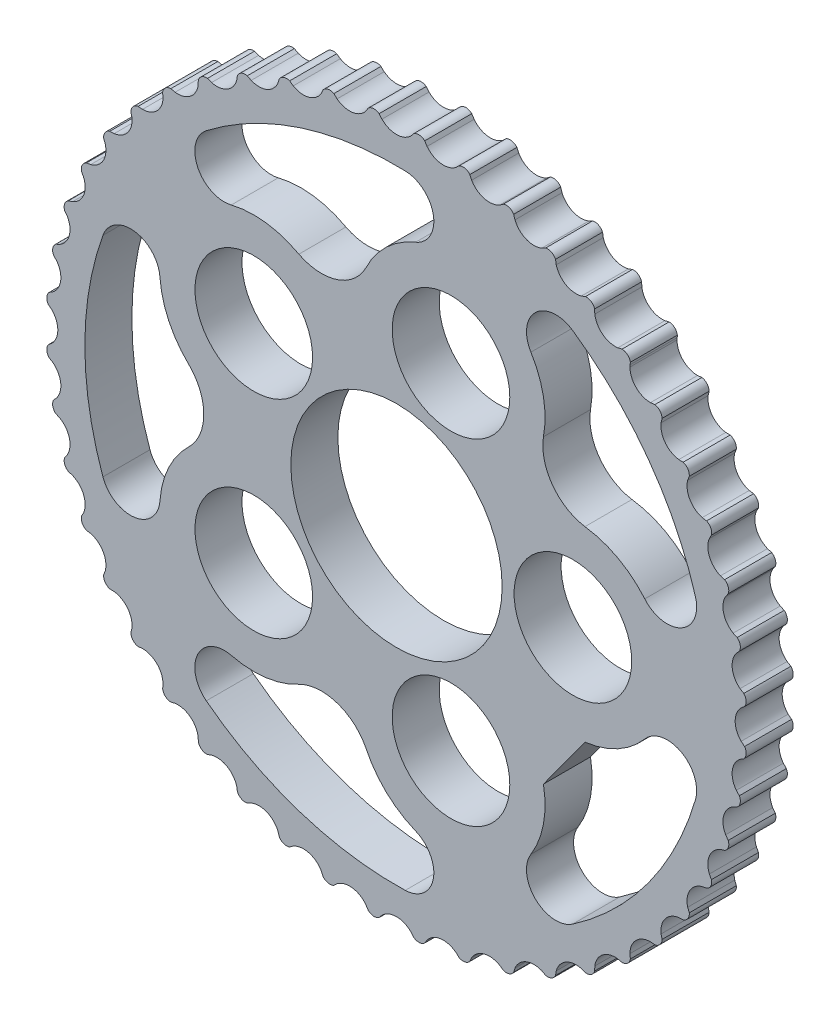
from build123d import *

# Parameters (mm, degrees)
SKETCH_1_R      = 8.985
SKETCH_1_R_2    = 5
EXTRUDE_1_DEPTH = 4


with BuildPart() as part:
    # 草图1 → 凸台-拉伸1 (new body)
    with BuildSketch(Plane.XY):
        with BuildLine():
            Line((29.597334483, -1.467967443), (29.308601455, -1.233462465))
            ThreePointArc((29.308601455, -1.233462465), (28.8, 0), (29.308601455, 1.233462465))
            Line((29.308601455, 1.233462465), (29.597070598, 1.473278304))
            ThreePointArc((29.597070598, 1.473278304), (29.736020929, 1.951681144), (29.535733385, 2.407818592))
            Line((29.535733385, 2.407818592), (29.218861465, 2.602630125))
            ThreePointArc((29.218861465, 2.602630125), (28.553612008, 3.759154336), (28.896863147, 5.048450169))
            Line((28.896863147, 5.048450169), (29.151562149, 5.32386713))
            ThreePointArc((29.151562149, 5.32386713), (29.22687964, 5.816313825), (28.968767699, 6.242406183))
            Line((28.968767699, 6.242406183), (28.629178655, 6.394190991))
            ThreePointArc((28.629178655, 6.394190991), (27.818663797, 7.453988499), (27.9906915, 8.777057492))
            Line((27.9906915, 8.777057492), (28.207262389, 9.083363113))
            ThreePointArc((28.207262389, 9.083363113), (28.217658337, 9.581427764), (27.906138366, 9.970184474))
            Line((27.906138366, 9.970184474), (27.54964266, 10.076345477))
            ThreePointArc((27.54964266, 10.076345477), (26.607730536, 11.021282852), (26.605591361, 12.355486928))
            Line((26.605591361, 12.355486928), (26.780328549, 12.687440235))
            ThreePointArc((26.780328549, 12.687440235), (26.725625076, 13.182600817), (26.366027268, 13.527370144))
            Line((26.366027268, 13.527370144), (25.998724641, 13.586090898))
            ThreePointArc((25.998724641, 13.586090898), (24.941531629, 14.4), (24.765262177, 15.722510556))
            Line((24.765262177, 15.722510556), (24.895175863, 16.074431737))
            ThreePointArc((24.895175863, 16.074431737), (24.77630896, 16.558215916), (24.374786134, 16.853098761))
            Line((24.374786134, 16.853098761), (24.002961236, 16.863374537))
            ThreePointArc((24.002961236, 16.863374537), (22.8485762, 17.532329155), (22.501192491, 18.82051767))
            Line((22.501192491, 18.82051767), (22.584059816, 19.186385256))
            ThreePointArc((22.584059816, 19.186385256), (22.403063329, 19.650515349), (21.966485652, 19.890466185))
            Line((21.966485652, 19.890466185), (21.596500509, 19.852121163))
            ThreePointArc((21.596500509, 19.852121163), (20.364675298, 20.364675298), (19.852121163, 21.596500509))
            Line((19.852121163, 21.596500509), (19.871293674, 21.78149308))
            Line((19.871293674, 21.78149308), (19.886524243, 21.970054403))
            ThreePointArc((19.886524243, 21.970054403), (19.646495073, 22.406589016), (19.182332509, 22.587502218))
            Line((19.182332509, 22.587502218), (18.82051767, 22.501192491))
            ThreePointArc((18.82051767, 22.501192491), (17.532329155, 22.8485762), (16.863374537, 24.002961236))
            Line((16.863374537, 24.002961236), (16.848724728, 24.377809828))
            ThreePointArc((16.848724728, 24.377809828), (16.553769839, 24.779279734), (16.069964339, 24.898059825))
            Line((16.069964339, 24.898059825), (15.722510556, 24.765262177))
            ThreePointArc((15.722510556, 24.765262177), (14.4, 24.941531629), (13.586090898, 25.998724641))
            Line((13.586090898, 25.998724641), (13.522638861, 26.368454168))
            ThreePointArc((13.522638861, 26.368454168), (13.177805014, 26.727990104), (12.682634624, 26.782604726))
            Line((12.682634624, 26.782604726), (12.355486928, 26.605591361))
            ThreePointArc((12.355486928, 26.605591361), (11.021282852, 26.607730536), (10.076345477, 27.54964266))
            Line((10.076345477, 27.54964266), (9.965176893, 27.907926946))
            ThreePointArc((9.965176893, 27.907926946), (9.576364291, 28.219377154), (9.078301514, 28.208891835))
            Line((9.078301514, 28.208891835), (8.777057492, 27.9906915))
            ThreePointArc((8.777057492, 27.9906915), (7.453988499, 27.818663797), (6.394190992, 28.629178655))
            Line((6.394190992, 28.629178655), (6.237207986, 28.969887357))
            ThreePointArc((6.237207986, 28.969887357), (5.81106932, 29.227922837), (5.318636148, 29.152516983))
            Line((5.318636148, 29.152516983), (5.048450169, 28.896863147))
            ThreePointArc((5.048450169, 28.896863147), (3.759154336, 28.553612008), (2.602630125, 29.218861465))
            Line((2.602630125, 29.218861465), (2.402518722, 29.536164963))
            ThreePointArc((2.402518722, 29.536164963), (1.946345342, 29.736370656), (1.467967443, 29.597334483))
            Line((1.467967443, 29.597334483), (1.233462465, 29.308601455))
            ThreePointArc((1.233462465, 29.308601455), (0, 28.8), (-1.233462465, 29.308601455))
            Line((-1.233462465, 29.308601455), (-1.473278304, 29.597070598))
            ThreePointArc((-1.473278304, 29.597070598), (-1.951681144, 29.736020929), (-2.407818592, 29.535733385))
            Line((-2.407818592, 29.535733385), (-2.602630125, 29.218861465))
            ThreePointArc((-2.602630125, 29.218861465), (-3.759154336, 28.553612008), (-5.048450169, 28.896863147))
            Line((-5.048450169, 28.896863147), (-5.32386713, 29.151562149))
            ThreePointArc((-5.32386713, 29.151562149), (-5.816313825, 29.22687964), (-6.242406183, 28.968767699))
            Line((-6.242406183, 28.968767699), (-6.394190991, 28.629178655))
            ThreePointArc((-6.394190991, 28.629178655), (-7.453988499, 27.818663797), (-8.777057492, 27.9906915))
            Line((-8.777057492, 27.9906915), (-9.083363113, 28.207262389))
            ThreePointArc((-9.083363113, 28.207262389), (-9.581427764, 28.217658337), (-9.970184474, 27.906138366))
            Line((-9.970184474, 27.906138366), (-10.076345477, 27.54964266))
            ThreePointArc((-10.076345477, 27.54964266), (-11.021282852, 26.607730536), (-12.355486928, 26.605591361))
            Line((-12.355486928, 26.605591361), (-12.687440235, 26.780328549))
            ThreePointArc((-12.687440235, 26.780328549), (-13.182600817, 26.725625076), (-13.527370144, 26.366027268))
            Line((-13.527370144, 26.366027268), (-13.586090898, 25.998724641))
            ThreePointArc((-13.586090898, 25.998724641), (-14.4, 24.941531629), (-15.722510556, 24.765262177))
            Line((-15.722510556, 24.765262177), (-16.074431737, 24.895175863))
            ThreePointArc((-16.074431737, 24.895175863), (-16.558215916, 24.77630896), (-16.853098761, 24.374786134))
            Line((-16.853098761, 24.374786134), (-16.863374537, 24.002961236))
            ThreePointArc((-16.863374537, 24.002961236), (-17.532329155, 22.8485762), (-18.82051767, 22.501192491))
            Line((-18.82051767, 22.501192491), (-19.186385256, 22.584059816))
            ThreePointArc((-19.186385256, 22.584059816), (-19.650515349, 22.403063329), (-19.890466185, 21.966485652))
            Line((-19.890466185, 21.966485652), (-19.852121163, 21.596500509))
            ThreePointArc((-19.852121163, 21.596500509), (-20.364675298, 20.364675298), (-21.596500509, 19.852121163))
            Line((-21.596500509, 19.852121163), (-21.970054403, 19.886524243))
            ThreePointArc((-21.970054403, 19.886524243), (-22.406589016, 19.646495073), (-22.587502218, 19.182332509))
            Line((-22.587502218, 19.182332509), (-22.501192491, 18.82051767))
            ThreePointArc((-22.501192491, 18.82051767), (-22.8485762, 17.532329155), (-24.002961236, 16.863374537))
            Line((-24.002961236, 16.863374537), (-24.377809828, 16.848724728))
            ThreePointArc((-24.377809828, 16.848724728), (-24.779279734, 16.553769839), (-24.898059825, 16.069964339))
            Line((-24.898059825, 16.069964339), (-24.765262177, 15.722510556))
            ThreePointArc((-24.765262177, 15.722510556), (-24.941531629, 14.4), (-25.998724641, 13.586090898))
            Line((-25.998724641, 13.586090898), (-26.368454168, 13.522638861))
            ThreePointArc((-26.368454168, 13.522638861), (-26.727990104, 13.177805014), (-26.782604726, 12.682634624))
            Line((-26.782604726, 12.682634624), (-26.605591361, 12.355486928))
            ThreePointArc((-26.605591361, 12.355486928), (-26.607730536, 11.021282852), (-27.54964266, 10.076345477))
            Line((-27.54964266, 10.076345477), (-27.907926946, 9.965176893))
            ThreePointArc((-27.907926946, 9.965176893), (-28.219377154, 9.576364291), (-28.208891835, 9.078301514))
            Line((-28.208891835, 9.078301514), (-27.9906915, 8.777057492))
            ThreePointArc((-27.9906915, 8.777057492), (-27.818663797, 7.453988499), (-28.629178655, 6.394190991))
            Line((-28.629178655, 6.394190991), (-28.969887357, 6.237207986))
            ThreePointArc((-28.969887357, 6.237207986), (-29.227922837, 5.81106932), (-29.152516983, 5.318636148))
            Line((-29.152516983, 5.318636148), (-28.896863147, 5.048450169))
            ThreePointArc((-28.896863147, 5.048450169), (-28.553612008, 3.759154336), (-29.218861465, 2.602630125))
            Line((-29.218861465, 2.602630125), (-29.536164963, 2.402518722))
            ThreePointArc((-29.536164963, 2.402518722), (-29.736370656, 1.946345342), (-29.597334483, 1.467967443))
            Line((-29.597334483, 1.467967443), (-29.308601455, 1.233462465))
            ThreePointArc((-29.308601455, 1.233462465), (-28.8, 0), (-29.308601455, -1.233462465))
            Line((-29.308601455, -1.233462465), (-29.597070598, -1.473278304))
            ThreePointArc((-29.597070598, -1.473278304), (-29.736020929, -1.951681144), (-29.535733385, -2.407818592))
            Line((-29.535733385, -2.407818592), (-29.218861465, -2.602630125))
            ThreePointArc((-29.218861465, -2.602630125), (-28.553612008, -3.759154336), (-28.896863147, -5.048450169))
            Line((-28.896863147, -5.048450169), (-29.151562149, -5.32386713))
            ThreePointArc((-29.151562149, -5.32386713), (-29.22687964, -5.816313825), (-28.968767699, -6.242406183))
            Line((-28.968767699, -6.242406183), (-28.629178655, -6.394190991))
            ThreePointArc((-28.629178655, -6.394190991), (-27.818663797, -7.453988499), (-27.9906915, -8.777057492))
            Line((-27.9906915, -8.777057492), (-28.207262389, -9.083363113))
            ThreePointArc((-28.207262389, -9.083363113), (-28.217658337, -9.581427764), (-27.906138366, -9.970184474))
            Line((-27.906138366, -9.970184474), (-27.54964266, -10.076345477))
            ThreePointArc((-27.54964266, -10.076345477), (-26.607730536, -11.021282852), (-26.605591361, -12.355486928))
            Line((-26.605591361, -12.355486928), (-26.780328549, -12.687440235))
            ThreePointArc((-26.780328549, -12.687440235), (-26.725625076, -13.182600817), (-26.366027268, -13.527370144))
            Line((-26.366027268, -13.527370144), (-25.998724641, -13.586090898))
            ThreePointArc((-25.998724641, -13.586090898), (-24.941531629, -14.4), (-24.765262177, -15.722510556))
            Line((-24.765262177, -15.722510556), (-24.895175863, -16.074431737))
            ThreePointArc((-24.895175863, -16.074431737), (-24.77630896, -16.558215916), (-24.374786134, -16.853098761))
            Line((-24.374786134, -16.853098761), (-24.002961236, -16.863374537))
            ThreePointArc((-24.002961236, -16.863374537), (-22.8485762, -17.532329155), (-22.501192491, -18.82051767))
            Line((-22.501192491, -18.82051767), (-22.584059816, -19.186385256))
            ThreePointArc((-22.584059816, -19.186385256), (-22.403063329, -19.650515349), (-21.966485652, -19.890466185))
            Line((-21.966485652, -19.890466185), (-21.596500509, -19.852121163))
            ThreePointArc((-21.596500509, -19.852121163), (-20.364675298, -20.364675298), (-19.852121163, -21.596500509))
            Line((-19.852121163, -21.596500509), (-19.886524243, -21.970054403))
            ThreePointArc((-19.886524243, -21.970054403), (-19.646495073, -22.406589016), (-19.182332509, -22.587502218))
            Line((-19.182332509, -22.587502218), (-18.82051767, -22.501192491))
            ThreePointArc((-18.82051767, -22.501192491), (-17.532329155, -22.8485762), (-16.863374537, -24.002961236))
            Line((-16.863374537, -24.002961236), (-16.848724728, -24.377809828))
            ThreePointArc((-16.848724728, -24.377809828), (-16.553769839, -24.779279734), (-16.069964339, -24.898059825))
            Line((-16.069964339, -24.898059825), (-15.722510556, -24.765262177))
            ThreePointArc((-15.722510556, -24.765262177), (-14.4, -24.941531629), (-13.586090898, -25.998724641))
            Line((-13.586090898, -25.998724641), (-13.522638861, -26.368454168))
            ThreePointArc((-13.522638861, -26.368454168), (-13.177805014, -26.727990104), (-12.682634624, -26.782604726))
            Line((-12.682634624, -26.782604726), (-12.355486928, -26.605591361))
            ThreePointArc((-12.355486928, -26.605591361), (-11.021282852, -26.607730536), (-10.076345477, -27.54964266))
            Line((-10.076345477, -27.54964266), (-9.965176893, -27.907926946))
            ThreePointArc((-9.965176893, -27.907926946), (-9.576364291, -28.219377154), (-9.078301514, -28.208891835))
            Line((-9.078301514, -28.208891835), (-8.777057492, -27.9906915))
            ThreePointArc((-8.777057492, -27.9906915), (-7.453988499, -27.818663797), (-6.394190991, -28.629178655))
            Line((-6.394190991, -28.629178655), (-6.237207986, -28.969887357))
            ThreePointArc((-6.237207986, -28.969887357), (-5.81106932, -29.227922837), (-5.318636148, -29.152516983))
            Line((-5.318636148, -29.152516983), (-5.048450169, -28.896863147))
            ThreePointArc((-5.048450169, -28.896863147), (-3.759154336, -28.553612008), (-2.602630125, -29.218861465))
            Line((-2.602630125, -29.218861465), (-2.402518722, -29.536164963))
            ThreePointArc((-2.402518722, -29.536164963), (-1.946345342, -29.736370656), (-1.467967443, -29.597334483))
            Line((-1.467967443, -29.597334483), (-1.233462465, -29.308601455))
            ThreePointArc((-1.233462465, -29.308601455), (0, -28.8), (1.233462465, -29.308601455))
            Line((1.233462465, -29.308601455), (1.473278304, -29.597070598))
            ThreePointArc((1.473278304, -29.597070598), (1.951681144, -29.736020929), (2.407818592, -29.535733385))
            Line((2.407818592, -29.535733385), (2.602630125, -29.218861465))
            ThreePointArc((2.602630125, -29.218861465), (3.759154336, -28.553612008), (5.048450169, -28.896863147))
            Line((5.048450169, -28.896863147), (5.32386713, -29.151562149))
            ThreePointArc((5.32386713, -29.151562149), (5.816313825, -29.22687964), (6.242406183, -28.968767699))
            Line((6.242406183, -28.968767699), (6.394190992, -28.629178655))
            ThreePointArc((6.394190992, -28.629178655), (7.453988499, -27.818663797), (8.777057492, -27.9906915))
            Line((8.777057492, -27.9906915), (9.083363113, -28.207262389))
            ThreePointArc((9.083363113, -28.207262389), (9.581427764, -28.217658337), (9.970184474, -27.906138366))
            Line((9.970184474, -27.906138366), (10.076345477, -27.54964266))
            ThreePointArc((10.076345477, -27.54964266), (11.021282852, -26.607730536), (12.355486928, -26.605591361))
            Line((12.355486928, -26.605591361), (12.687440235, -26.780328549))
            ThreePointArc((12.687440235, -26.780328549), (13.182600817, -26.725625076), (13.527370144, -26.366027268))
            Line((13.527370144, -26.366027268), (13.586090898, -25.998724641))
            ThreePointArc((13.586090898, -25.998724641), (14.4, -24.941531629), (15.722510556, -24.765262177))
            Line((15.722510556, -24.765262177), (16.074431737, -24.895175863))
            ThreePointArc((16.074431737, -24.895175863), (16.558215916, -24.77630896), (16.853098761, -24.374786134))
            Line((16.853098761, -24.374786134), (16.863374537, -24.002961236))
            ThreePointArc((16.863374537, -24.002961236), (17.532329155, -22.8485762), (18.82051767, -22.501192491))
            Line((18.82051767, -22.501192491), (19.186385256, -22.584059816))
            ThreePointArc((19.186385256, -22.584059816), (19.650515349, -22.403063329), (19.890466185, -21.966485652))
            Line((19.890466185, -21.966485652), (19.852121163, -21.596500509))
            ThreePointArc((19.852121163, -21.596500509), (20.364675298, -20.364675298), (21.596500509, -19.852121163))
            Line((21.596500509, -19.852121163), (21.970054403, -19.886524243))
            ThreePointArc((21.970054403, -19.886524243), (22.406589016, -19.646495073), (22.587502218, -19.182332509))
            Line((22.587502218, -19.182332509), (22.501192491, -18.82051767))
            ThreePointArc((22.501192491, -18.82051767), (22.8485762, -17.532329155), (24.002961236, -16.863374537))
            Line((24.002961236, -16.863374537), (24.377809828, -16.848724728))
            ThreePointArc((24.377809828, -16.848724728), (24.779279734, -16.553769839), (24.898059825, -16.069964339))
            Line((24.898059825, -16.069964339), (24.765262177, -15.722510556))
            ThreePointArc((24.765262177, -15.722510556), (24.941531629, -14.4), (25.998724641, -13.586090898))
            Line((25.998724641, -13.586090898), (26.368454168, -13.522638861))
            ThreePointArc((26.368454168, -13.522638861), (26.727990104, -13.177805014), (26.782604726, -12.682634624))
            Line((26.782604726, -12.682634624), (26.605591361, -12.355486928))
            ThreePointArc((26.605591361, -12.355486928), (26.607730536, -11.021282852), (27.54964266, -10.076345477))
            Line((27.54964266, -10.076345477), (27.907926946, -9.965176893))
            ThreePointArc((27.907926946, -9.965176893), (28.219377154, -9.576364291), (28.208891835, -9.078301514))
            Line((28.208891835, -9.078301514), (27.9906915, -8.777057492))
            ThreePointArc((27.9906915, -8.777057492), (27.818663797, -7.453988499), (28.629178655, -6.394190991))
            Line((28.629178655, -6.394190991), (28.969887357, -6.237207986))
            ThreePointArc((28.969887357, -6.237207986), (29.227922837, -5.81106932), (29.152516983, -5.318636148))
            Line((29.152516983, -5.318636148), (28.896863147, -5.048450169))
            ThreePointArc((28.896863147, -5.048450169), (28.553612008, -3.759154336), (29.218861465, -2.602630125))
            Line((29.218861465, -2.602630125), (29.536164963, -2.402518722))
            ThreePointArc((29.536164963, -2.402518722), (29.736370656, -1.946345342), (29.597334483, -1.467967443))
        make_face()
        Circle(SKETCH_1_R, mode=Mode.SUBTRACT)
        with Locations((15, 0)):
            Circle(SKETCH_1_R_2, mode=Mode.SUBTRACT)
        with Locations((4.635254916, -14.265847744)):
            Circle(SKETCH_1_R_2, mode=Mode.SUBTRACT)
        with Locations((-12.135254916, -8.816778784)):
            Circle(SKETCH_1_R_2, mode=Mode.SUBTRACT)
        with Locations((-12.135254916, 8.816778784)):
            Circle(SKETCH_1_R_2, mode=Mode.SUBTRACT)
        with Locations((4.635254916, 14.265847744)):
            Circle(SKETCH_1_R_2, mode=Mode.SUBTRACT)
        with BuildLine():
            Line((12.497615506, -12.788253096), (16.02432702, -7.93415113))
            ThreePointArc((16.02432702, -7.93415113), (18.829527787, -7.023867662), (21.114285714, -5.159022214))
            ThreePointArc((21.114285714, -5.159022214), (24.209147052, -4.569445605), (25.4234375, -7.476551724))
            ThreePointArc((25.4234375, -7.476551724), (21.438950351, -15.576309186), (14.96689748, -21.868744359))
            ThreePointArc((14.96689748, -21.868744359), (11.826838877, -21.612230711), (11.431194804, -18.486653477))
            ThreePointArc((11.431194804, -18.486653477), (12.498739192, -15.737450626), (12.497615506, -12.788253096))
        make_face(mode=Mode.SUBTRACT)
        with BuildLine():
            ThreePointArc((-8.300375859, 15.8377262), (-5.06320922, 15.582955661), (-2.594036761, 17.691828167))
            ThreePointArc((-2.594036761, 17.691828167), (-0.861451027, 20.078439574), (1.618151416, 21.675104554))
            ThreePointArc((1.618151416, 21.675104554), (3.13523684, 24.436303405), (0.745651006, 26.489507443))
            ThreePointArc((0.745651006, 26.489507443), (-8.188950351, 25.202997682), (-16.173386151, 20.992179029))
            ThreePointArc((-16.173386151, 20.992179029), (-16.899758647, 17.926538757), (-14.049418793, 16.584402401))
            ThreePointArc((-14.049418793, 16.584402401), (-11.10488215, 16.750147045), (-8.300375859, 15.8377262))
        make_face(mode=Mode.SUBTRACT)
        with BuildLine():
            ThreePointArc((16.02432702, 7.93415113), (18.829527787, 7.023867662), (21.114285714, 5.159022214))
            ThreePointArc((21.114285714, 5.159022214), (24.209147052, 4.569445605), (25.4234375, 7.476551724))
            ThreePointArc((25.4234375, 7.476551724), (21.438950351, 15.576309186), (14.96689748, 21.868744359))
            ThreePointArc((14.96689748, 21.868744359), (11.826838877, 21.612230711), (11.431194804, 18.486653477))
            ThreePointArc((11.431194804, 18.486653477), (12.498739192, 15.737450626), (12.497615506, 12.788253096))
            ThreePointArc((12.497615506, 12.788253096), (13.255653829, 9.630796243), (16.02432702, 7.93415113))
        make_face(mode=Mode.SUBTRACT)
        with BuildLine():
            ThreePointArc((-8.300375859, -15.8377262), (-11.10488215, -16.750147045), (-14.049418793, -16.584402401))
            ThreePointArc((-14.049418793, -16.584402401), (-16.899758647, -17.926538757), (-16.173386151, -20.992179029))
            ThreePointArc((-16.173386151, -20.992179029), (-8.188950351, -25.202997682), (0.745651006, -26.489507443))
            ThreePointArc((0.745651006, -26.489507443), (3.13523684, -24.436303405), (1.618151416, -21.675104554))
            ThreePointArc((1.618151416, -21.675104554), (-0.861451027, -20.078439574), (-2.594036761, -17.691828167))
            ThreePointArc((-2.594036761, -17.691828167), (-5.06320922, -15.582955661), (-8.300375859, -15.8377262))
        make_face(mode=Mode.SUBTRACT)
        with BuildLine():
            ThreePointArc((-17.627529906, 3), (-19.361933801, 5.385290436), (-20.114213141, 8.23692911))
            ThreePointArc((-20.114213141, 8.23692911), (-22.271464122, 10.533020458), (-24.962599834, 8.894864221))
            ThreePointArc((-24.962599834, 8.894864221), (-26.5, 0), (-24.962599834, -8.894864221))
            ThreePointArc((-24.962599834, -8.894864221), (-22.271464122, -10.533020458), (-20.114213141, -8.23692911))
            ThreePointArc((-20.114213141, -8.23692911), (-19.361933801, -5.385290436), (-17.627529906, -3))
            ThreePointArc((-17.627529906, -3), (-16.384889219, 0), (-17.627529906, 3))
        make_face(mode=Mode.SUBTRACT)
    extrude(amount=EXTRUDE_1_DEPTH)


solid = part.part
